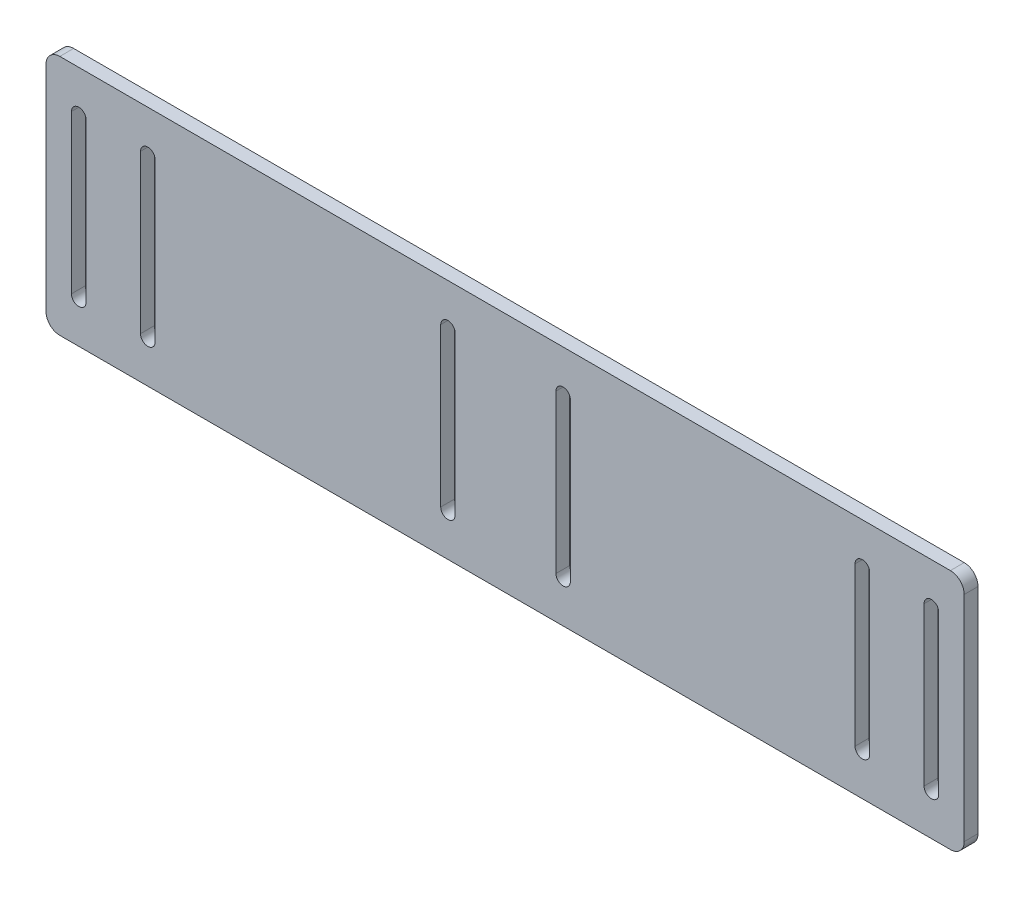
from build123d import *

# Parameters (mm, degrees)
BOSS_EXTRUDE3_DEPTH = 8
FILLET1_R           = 8
CUT_EXTRUDE3_DEPTH  = 10


with BuildPart() as part:
    # Sketch2 → Boss-Extrude3 (new body)
    with BuildSketch(Plane.XY.offset(-1552.384718604)):
        Polygon((-493.118842126, 700), (-493.118842126, 560), (-480.118842126, 560), (38.881157874, 560), (38.881157874, 700), (-480.118842126, 700), align=None)
        with BuildLine():
            Line((15.631157874, 584.25), (15.631157874, 675.75))
            ThreePointArc((15.631157874, 675.75), (19.881157874, 680), (24.131157874, 675.75))
            Line((24.131157874, 675.75), (24.131157874, 584.25))
            ThreePointArc((24.131157874, 584.25), (19.881157874, 580), (15.631157874, 584.25))
        make_face(mode=Mode.SUBTRACT)
        with BuildLine():
            Line((-15.868842127, 584.25), (-15.868842127, 675.75))
            ThreePointArc((-15.868842127, 675.75), (-20.118842127, 680), (-24.368842127, 675.75))
            Line((-24.368842127, 675.75), (-24.368842127, 584.25))
            ThreePointArc((-24.368842127, 584.25), (-20.118842127, 580), (-15.868842127, 584.25))
        make_face(mode=Mode.SUBTRACT)
        with BuildLine():
            Line((-438.368842126, 584.25), (-438.368842126, 675.75))
            ThreePointArc((-438.368842126, 675.75), (-434.118842126, 680), (-429.868842126, 675.75))
            Line((-429.868842126, 675.75), (-429.868842126, 584.25))
            ThreePointArc((-429.868842126, 584.25), (-434.118842126, 580), (-438.368842126, 584.25))
        make_face(mode=Mode.SUBTRACT)
        with BuildLine():
            Line((-469.868842126, 584.25), (-469.868842126, 675.75))
            ThreePointArc((-469.868842126, 675.75), (-474.118842126, 680), (-478.368842126, 675.75))
            Line((-478.368842126, 675.75), (-478.368842126, 584.25))
            ThreePointArc((-478.368842126, 584.25), (-474.118842126, 580), (-469.868842126, 584.25))
        make_face(mode=Mode.SUBTRACT)
    extrude(amount=BOSS_EXTRUDE3_DEPTH)

    # Fillet1
    fillet1_edges = [part.edges().sort_by_distance(p)[0] for p in [
        (-493.118842126, 560, -1548.384718604),
        (-493.118842126, 700, -1548.384718604),
        (38.881157874, 700, -1548.384718604),
        (38.881157874, 560, -1548.384718604),
    ]]
    fillet(fillet1_edges, radius=FILLET1_R)

    # Sketch7 → Cut-Extrude3 (cut)
    with BuildSketch(Plane.XY.offset(-1544.384718604)):
        with BuildLine():
            Line((-256.068842126, 675.75), (-256.068842126, 584.25))
            ThreePointArc((-256.068842126, 584.25), (-260.243842126, 580.075), (-264.418842126, 584.25))
            Line((-264.418842126, 584.25), (-264.418842126, 675.75))
            ThreePointArc((-264.418842126, 675.75), (-260.243842126, 679.925), (-256.068842126, 675.75))
        make_face()
        with BuildLine():
            Line((-197.668842126, 675.75), (-197.668842126, 584.25))
            ThreePointArc((-197.668842126, 584.25), (-193.493842126, 580.075), (-189.318842126, 584.25))
            Line((-189.318842126, 584.25), (-189.318842126, 675.75))
            ThreePointArc((-189.318842126, 675.75), (-193.493842126, 679.925), (-197.668842126, 675.75))
        make_face()
    extrude(amount=-CUT_EXTRUDE3_DEPTH, mode=Mode.SUBTRACT)


solid = part.part
